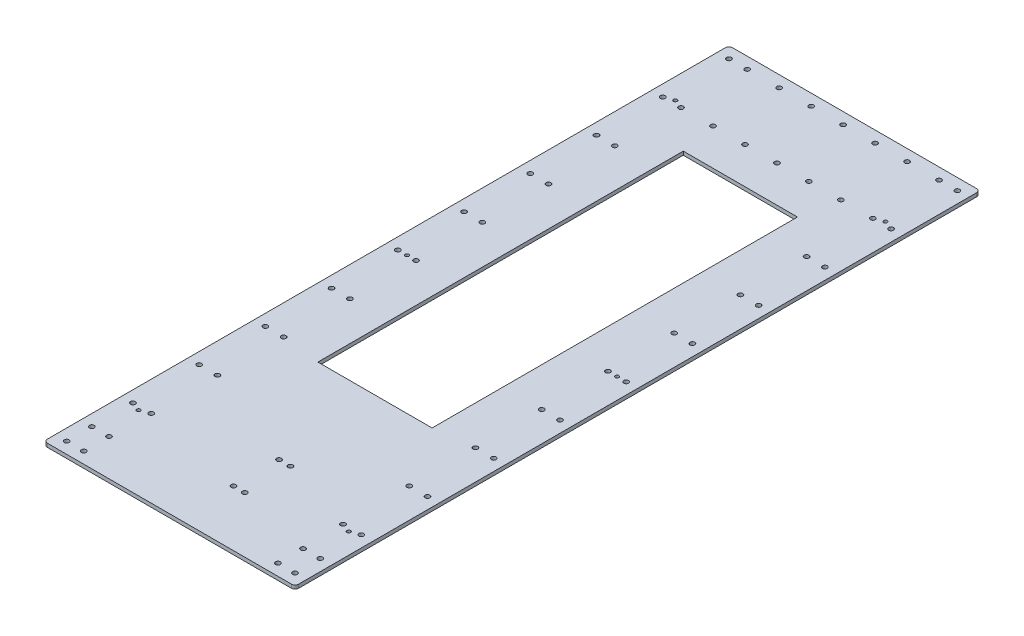
from build123d import *

# Parameters (mm, degrees)
SKETCH1_W           = 220
SKETCH1_H           = 600
SKETCH1_R           = 2.1
SKETCH1_R_2         = 1.6
SKETCH1_W_2         = 100
SKETCH1_H_2         = 320
BOSS_EXTRUDE1_DEPTH = 3.175
FILLET1_R           = 3.2


with BuildPart() as part:
    # Sketch1 → Boss-Extrude1 (new body)
    with BuildSketch(Plane(origin=(0, 0, 0), x_dir=(1, 0, 0), z_dir=(0, 1, 0))):
        Rectangle(SKETCH1_W, SKETCH1_H)
        with Locations(Location((100, 290, 0), (0, 0, 270))):
            Circle(SKETCH1_R, mode=Mode.SUBTRACT)
        with Locations(Location((100, 232, 0), (0, 0, 270))):
            Circle(SKETCH1_R, mode=Mode.SUBTRACT)
        with Locations(Location((100, 174, 0), (0, 0, 270))):
            Circle(SKETCH1_R, mode=Mode.SUBTRACT)
        with Locations(Location((100, 116, 0), (0, 0, 270))):
            Circle(SKETCH1_R, mode=Mode.SUBTRACT)
        with Locations(Location((100, 58, 0), (0, 0, 270))):
            Circle(SKETCH1_R, mode=Mode.SUBTRACT)
        with Locations(Location((100, 0, 0), (0, 0, 270))):
            Circle(SKETCH1_R, mode=Mode.SUBTRACT)
        with Locations(Location((100, -58, 0), (0, 0, 270))):
            Circle(SKETCH1_R, mode=Mode.SUBTRACT)
        with Locations(Location((100, -116, 0), (0, 0, 270))):
            Circle(SKETCH1_R, mode=Mode.SUBTRACT)
        with Locations(Location((100, -174, 0), (0, 0, 270))):
            Circle(SKETCH1_R, mode=Mode.SUBTRACT)
        with Locations(Location((100, -232, 0), (0, 0, 270))):
            Circle(SKETCH1_R, mode=Mode.SUBTRACT)
        with Locations(Location((100, -290, 0), (0, 0, 270))):
            Circle(SKETCH1_R, mode=Mode.SUBTRACT)
        with Locations(Location((84, -232, 0), (0, 0, 90))):
            Circle(SKETCH1_R, mode=Mode.SUBTRACT)
        with Locations(Location((84, -174, 0), (0, 0, 90))):
            Circle(SKETCH1_R, mode=Mode.SUBTRACT)
        with Locations(Location((84, -116, 0), (0, 0, 90))):
            Circle(SKETCH1_R, mode=Mode.SUBTRACT)
        with Locations(Location((84, -58, 0), (0, 0, 90))):
            Circle(SKETCH1_R, mode=Mode.SUBTRACT)
        with Locations(Location((84, 0, 0), (0, 0, 90))):
            Circle(SKETCH1_R, mode=Mode.SUBTRACT)
        with Locations(Location((84, 58, 0), (0, 0, 90))):
            Circle(SKETCH1_R, mode=Mode.SUBTRACT)
        with Locations(Location((84, 116, 0), (0, 0, 90))):
            Circle(SKETCH1_R, mode=Mode.SUBTRACT)
        with Locations(Location((84, 174, 0), (0, 0, 90))):
            Circle(SKETCH1_R, mode=Mode.SUBTRACT)
        with Locations(Location((84, 232, 0), (0, 0, 90))):
            Circle(SKETCH1_R, mode=Mode.SUBTRACT)
        with Locations(Location((84, 290, 0), (0, 0, 90))):
            Circle(SKETCH1_R, mode=Mode.SUBTRACT)
        with Locations(Location((92, 0, 0), (0, 0, 270))):
            Circle(SKETCH1_R_2, mode=Mode.SUBTRACT)
        with Locations(Location((92, 235, 0), (0, 0, 270))):
            Circle(SKETCH1_R_2, mode=Mode.SUBTRACT)
        with Locations(Location((92, -235, 0), (0, 0, 90))):
            Circle(SKETCH1_R_2, mode=Mode.SUBTRACT)
        with Locations(Location((-92, 235, 0), (0, 0, 90))):
            Circle(SKETCH1_R_2, mode=Mode.SUBTRACT)
        with Locations(Location((-84, 290, 0), (0, 0, 270))):
            Circle(SKETCH1_R, mode=Mode.SUBTRACT)
        with Locations(Location((-84, 232, 0), (0, 0, 270))):
            Circle(SKETCH1_R, mode=Mode.SUBTRACT)
        with Locations(Location((-84, 174, 0), (0, 0, 270))):
            Circle(SKETCH1_R, mode=Mode.SUBTRACT)
        with Locations(Location((-84, 116, 0), (0, 0, 270))):
            Circle(SKETCH1_R, mode=Mode.SUBTRACT)
        with Locations(Location((-100, 116, 0), (0, 0, 90))):
            Circle(SKETCH1_R, mode=Mode.SUBTRACT)
        with Locations(Location((-100, 174, 0), (0, 0, 90))):
            Circle(SKETCH1_R, mode=Mode.SUBTRACT)
        with Locations(Location((-100, 232, 0), (0, 0, 90))):
            Circle(SKETCH1_R, mode=Mode.SUBTRACT)
        with Locations(Location((-100, 290, 0), (0, 0, 90))):
            Circle(SKETCH1_R, mode=Mode.SUBTRACT)
        with Locations(Location((-92, -235, 0), (0, 0, 270))):
            Circle(SKETCH1_R_2, mode=Mode.SUBTRACT)
        with Locations(Location((-92, 0, 0), (0, 0, 90))):
            Circle(SKETCH1_R_2, mode=Mode.SUBTRACT)
        with Locations(Location((-84, 58, 0), (0, 0, 270))):
            Circle(SKETCH1_R, mode=Mode.SUBTRACT)
        with Locations(Location((-84, 0, 0), (0, 0, 270))):
            Circle(SKETCH1_R, mode=Mode.SUBTRACT)
        with Locations(Location((-84, -58, 0), (0, 0, 270))):
            Circle(SKETCH1_R, mode=Mode.SUBTRACT)
        with Locations(Location((-84, -116, 0), (0, 0, 270))):
            Circle(SKETCH1_R, mode=Mode.SUBTRACT)
        with Locations(Location((-84, -174, 0), (0, 0, 270))):
            Circle(SKETCH1_R, mode=Mode.SUBTRACT)
        with Locations(Location((-84, -232, 0), (0, 0, 270))):
            Circle(SKETCH1_R, mode=Mode.SUBTRACT)
        with Locations(Location((-100, -290, 0), (0, 0, 90))):
            Circle(SKETCH1_R, mode=Mode.SUBTRACT)
        with Locations(Location((-100, -232, 0), (0, 0, 90))):
            Circle(SKETCH1_R, mode=Mode.SUBTRACT)
        with Locations(Location((-100, -174, 0), (0, 0, 90))):
            Circle(SKETCH1_R, mode=Mode.SUBTRACT)
        with Locations(Location((-100, -116, 0), (0, 0, 90))):
            Circle(SKETCH1_R, mode=Mode.SUBTRACT)
        with Locations(Location((-100, -58, 0), (0, 0, 90))):
            Circle(SKETCH1_R, mode=Mode.SUBTRACT)
        with Locations(Location((-100, 0, 0), (0, 0, 90))):
            Circle(SKETCH1_R, mode=Mode.SUBTRACT)
        with Locations(Location((-100, 58, 0), (0, 0, 90))):
            Circle(SKETCH1_R, mode=Mode.SUBTRACT)
        with Locations(Location((56, 290, 0), (0, 0, 90))):
            Circle(SKETCH1_R, mode=Mode.SUBTRACT)
        with Locations(Location((28, 290, 0), (0, 0, 90))):
            Circle(SKETCH1_R, mode=Mode.SUBTRACT)
        with Locations(Location((0, 290, 0), (0, 0, 90))):
            Circle(SKETCH1_R, mode=Mode.SUBTRACT)
        with Locations(Location((-28, 290, 0), (0, 0, 90))):
            Circle(SKETCH1_R, mode=Mode.SUBTRACT)
        with Locations(Location((-56, 290, 0), (0, 0, 90))):
            Circle(SKETCH1_R, mode=Mode.SUBTRACT)
        with Locations(Location((56, 232, 0), (0, 0, 90))):
            Circle(SKETCH1_R, mode=Mode.SUBTRACT)
        with Locations(Location((28, 232, 0), (0, 0, 90))):
            Circle(SKETCH1_R, mode=Mode.SUBTRACT)
        with Locations(Location((0, 232, 0), (0, 0, 90))):
            Circle(SKETCH1_R, mode=Mode.SUBTRACT)
        with Locations(Location((-28, 232, 0), (0, 0, 90))):
            Circle(SKETCH1_R, mode=Mode.SUBTRACT)
        with Locations(Location((-56, 232, 0), (0, 0, 90))):
            Circle(SKETCH1_R, mode=Mode.SUBTRACT)
        with Locations(Location((85, -290, 0), (0, 0, 270))):
            Circle(SKETCH1_R, mode=Mode.SUBTRACT)
        with Locations(Location((85, -268, 0), (0, 0, 90))):
            Circle(SKETCH1_R, mode=Mode.SUBTRACT)
        with Locations(Location((100, -268, 0), (0, 0, 90))):
            Circle(SKETCH1_R, mode=Mode.SUBTRACT)
        with Locations(Location((-85, -290, 0), (0, 0, 90))):
            Circle(SKETCH1_R, mode=Mode.SUBTRACT)
        with Locations(Location((-100, -268, 0), (0, 0, 270))):
            Circle(SKETCH1_R, mode=Mode.SUBTRACT)
        with Locations(Location((-85, -268, 0), (0, 0, 270))):
            Circle(SKETCH1_R, mode=Mode.SUBTRACT)
        with Locations(Location((17, -251, 0), (0, 0, 270))):
            Circle(SKETCH1_R, mode=Mode.SUBTRACT)
        with Locations(Location((7, -251, 0), (0, 0, 270))):
            Circle(SKETCH1_R, mode=Mode.SUBTRACT)
        with Locations(Location((17, -211, 0), (0, 0, 90))):
            Circle(SKETCH1_R, mode=Mode.SUBTRACT)
        with Locations(Location((7, -211, 0), (0, 0, 90))):
            Circle(SKETCH1_R, mode=Mode.SUBTRACT)
        with Locations((0, 40)):
            Rectangle(SKETCH1_W_2, SKETCH1_H_2, mode=Mode.SUBTRACT)
    extrude(amount=BOSS_EXTRUDE1_DEPTH)

    # Fillet1
    fillet1_edges = [part.edges().sort_by_distance(p)[0] for p in [
        (110, 1.5875, 300),
        (-110, 1.5875, 300),
        (-110, 1.5875, -300),
        (110, 1.5875, -300),
    ]]
    fillet(fillet1_edges, radius=FILLET1_R)


solid = part.part
